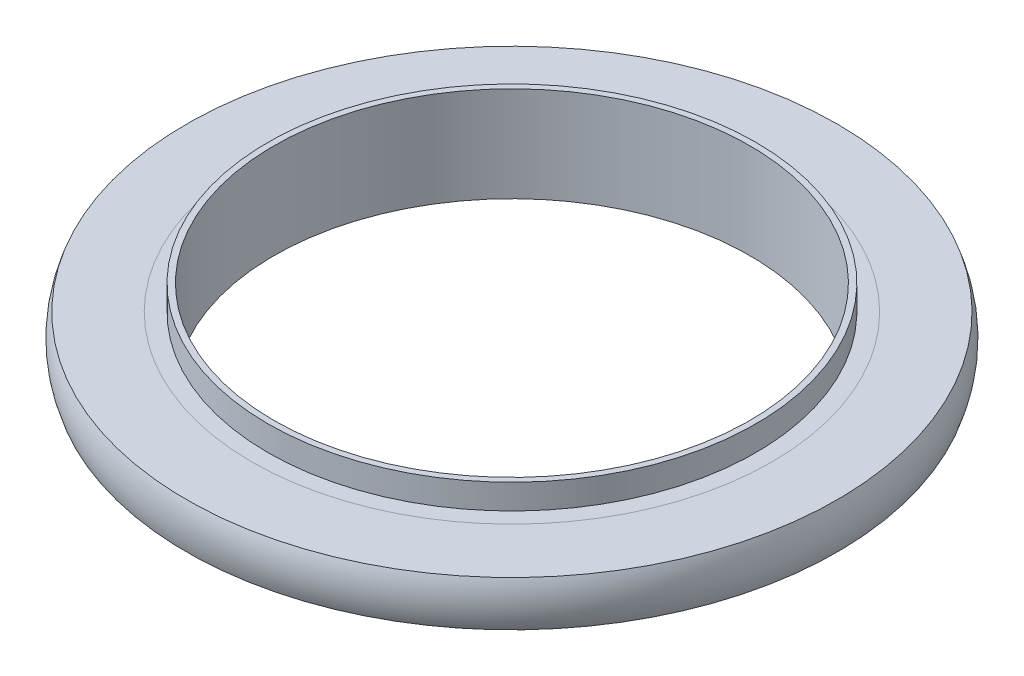
from build123d import *


with BuildPart() as part:
    # Sketch1 → Revolve1 (revolve)
    with BuildSketch(Plane.XY, mode=Mode.PRIVATE) as revolve1_sk:
        with BuildLine():
            Line((20, 4), (20, -4))
            Line((20, -4), (20.5, -4))
            Line((20.5, -4), (20.5, -1.905))
            Line((20.5, -1.905), (21.854196223, -1.905))
            ThreePointArc((21.854196223, -1.905), (21.5, 0), (21.854196223, 1.905))
            Line((21.854196223, 1.905), (20.5, 1.905))
            Line((20.5, 1.905), (20.5, 4))
            Line((20.5, 4), (20, 4))
        make_face()
    revolve(revolve1_sk.sketch.rotate(Axis((0, 4, 0), (0, -1, 0)), 90), axis=Axis((0, 4, 0), (0, -1, 0)))


with BuildPart() as body_2:
    # Sketch2 → Revolve2 (revolve)
    with BuildSketch(Plane.XY, mode=Mode.PRIVATE) as revolve2_sk:
        with BuildLine():
            Line((21.854196223, 1.905), (27.345803777, 1.905))
            ThreePointArc((27.345803777, 1.905), (27.7, 0), (27.345803777, -1.905))
            Line((27.345803777, -1.905), (21.854196223, -1.905))
            ThreePointArc((21.854196223, -1.905), (21.5, 0), (21.854196223, 1.905))
        make_face()
    revolve(revolve2_sk.sketch.rotate(Axis((0, -4, 0), (0, 1, 0)), 90), axis=Axis((0, -4, 0), (0, 1, 0)))


solid = Compound([part.part, body_2.part])
